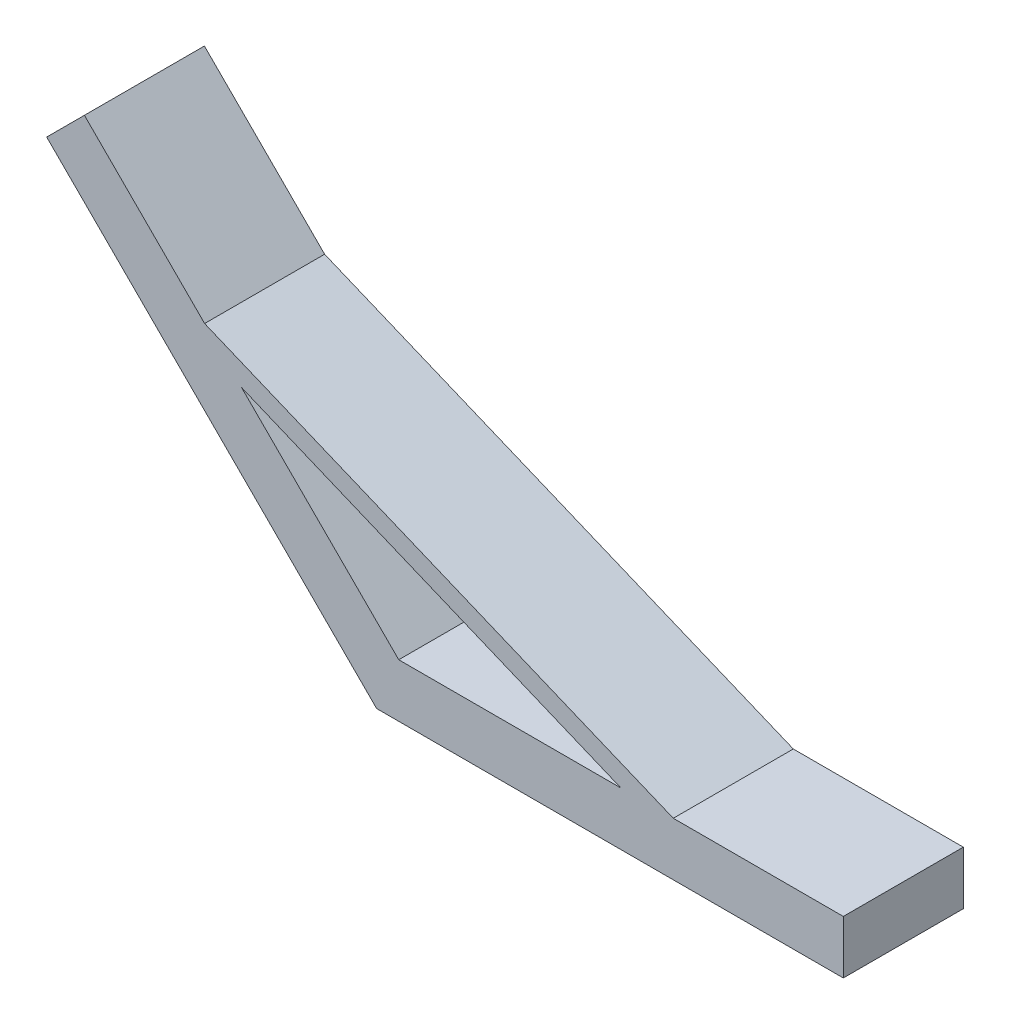
from build123d import *

# Parameters (mm, degrees)
EXTRUDE_1_DEPTH = 18


with BuildPart() as part:
    # 草图1 → 凸台-拉伸1 (new body)
    with BuildSketch(Plane.XY):
        Polygon((70, 8), (70, 0), (0, 0), (-49.497474683, 49.497474683), (-43.840620434, 55.154328933), (3.313708499, 8), align=None)
        Polygon((36.656854249, 8), (44.496232039, 8), (-25.806733162, 37.120441661), (-20.263455967, 31.577164466), align=None)
    extrude(amount=EXTRUDE_1_DEPTH)


solid = part.part
